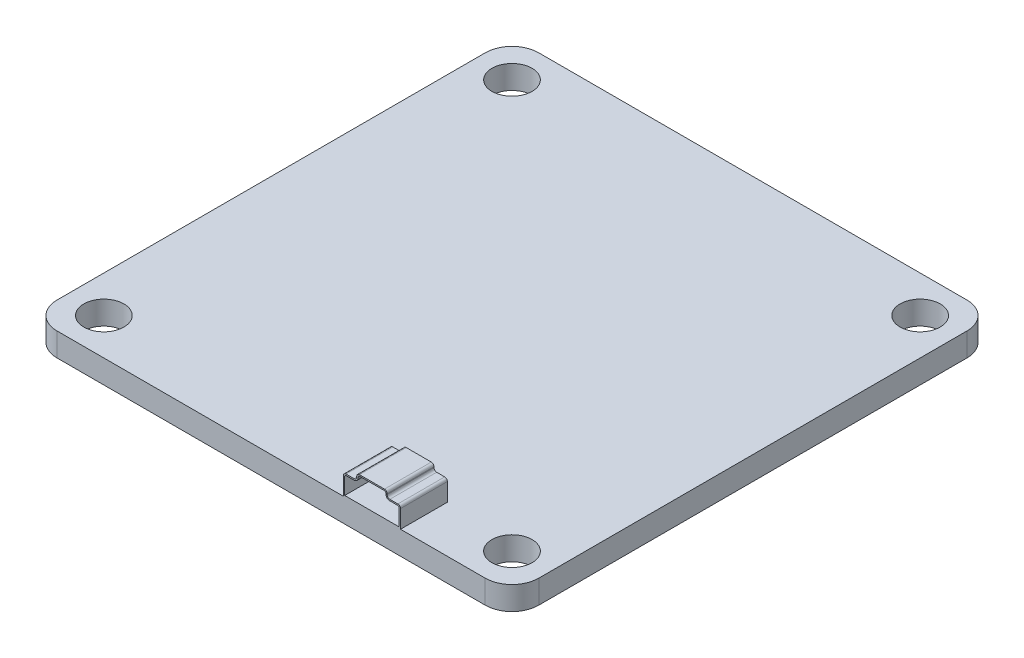
from build123d import *

# Parameters (mm, degrees)
SKETCH1_R           = 1.5
BOSS_EXTRUDE1_DEPTH = 1.75
BOSS_EXTRUDE2_DEPTH = 3
BOSS_EXTRUDE3_DEPTH = 0.5
CUT_EXTRUDE1_REACH  = 39.34
SKETCH6_R           = 0.257889393


with BuildPart() as part:
    # Sketch1 → Boss-Extrude1 (new body)
    with BuildSketch(Plane(origin=(0, 0, 0), x_dir=(1, 0, 0), z_dir=(0, 1, 0))):
        with BuildLine():
            Line((-16, 18), (16, 18))
            ThreePointArc((16, 18), (17.414213562, 17.414213562), (18, 16))
            Line((18, 16), (18, -16))
            ThreePointArc((18, -16), (17.414213562, -17.414213562), (16, -18))
            Line((16, -18), (-16, -18))
            ThreePointArc((-16, -18), (-17.414213562, -17.414213562), (-18, -16))
            Line((-18, -16), (-18, 16))
            ThreePointArc((-18, 16), (-17.414213562, 17.414213562), (-16, 18))
        make_face()
        with Locations(Location((-15.25, 15.25, 0), (0, 0, 270))):
            Circle(SKETCH1_R, mode=Mode.SUBTRACT)
        with Locations(Location((15.25, 15.25, 0), (0, 0, 270))):
            Circle(SKETCH1_R, mode=Mode.SUBTRACT)
        with Locations(Location((15.25, -15.25, 0), (0, 0, 270))):
            Circle(SKETCH1_R, mode=Mode.SUBTRACT)
        with Locations(Location((-15.25, -15.25, 0), (0, 0, 270))):
            Circle(SKETCH1_R, mode=Mode.SUBTRACT)
    extrude(amount=BOSS_EXTRUDE1_DEPTH)

    # Sketch2 → Boss-Extrude2 (add)
    with BuildSketch(Plane.XY.offset(18)):
        with BuildLine():
            Line((5.398268184, 1.75), (9.670358353, 1.75))
            Line((9.670358353, 1.75), (9.670358353, 3.08952509))
            ThreePointArc((9.670358353, 3.08952509), (9.61177971, 3.230946447), (9.470358353, 3.28952509))
            Line((9.470358353, 3.28952509), (8.870358353, 3.28952509))
            ThreePointArc((8.870358353, 3.28952509), (8.728936997, 3.348103734), (8.670358353, 3.48952509))
            Line((8.670358353, 3.48952509), (8.670358353, 3.55))
            ThreePointArc((8.670358353, 3.55), (8.61177971, 3.691421356), (8.470358353, 3.75))
            Line((8.470358353, 3.75), (6.598268184, 3.75))
            ThreePointArc((6.598268184, 3.75), (6.456846827, 3.691421356), (6.398268184, 3.55))
            Line((6.398268184, 3.55), (6.398268184, 3.48952509))
            ThreePointArc((6.398268184, 3.48952509), (6.33968954, 3.348103734), (6.198268184, 3.28952509))
            Line((6.198268184, 3.28952509), (5.598268184, 3.28952509))
            ThreePointArc((5.598268184, 3.28952509), (5.456846827, 3.230946447), (5.398268184, 3.08952509))
            Line((5.398268184, 3.08952509), (5.398268184, 1.75))
        make_face()
        with BuildLine():
            Line((6.598268184, 3.65), (8.470358353, 3.65))
            ThreePointArc((8.470358353, 3.65), (8.541069032, 3.620710678), (8.570358353, 3.55))
            Line((8.570358353, 3.55), (8.570358353, 3.48952509))
            ThreePointArc((8.570358353, 3.48952509), (8.658226319, 3.277393056), (8.870358353, 3.18952509))
            Line((8.870358353, 3.18952509), (9.470358353, 3.18952509))
            ThreePointArc((9.470358353, 3.18952509), (9.541069032, 3.160235768), (9.570358353, 3.08952509))
            Line((9.570358353, 3.08952509), (9.570358353, 1.85))
            Line((9.570358353, 1.85), (5.498268184, 1.85))
            Line((5.498268184, 1.85), (5.498268184, 3.08952509))
            ThreePointArc((5.498268184, 3.08952509), (5.527557505, 3.160235768), (5.598268184, 3.18952509))
            Line((5.598268184, 3.18952509), (6.198268184, 3.18952509))
            ThreePointArc((6.198268184, 3.18952509), (6.410400218, 3.277393056), (6.498268184, 3.48952509))
            Line((6.498268184, 3.48952509), (6.498268184, 3.55))
            ThreePointArc((6.498268184, 3.55), (6.527557505, 3.620710678), (6.598268184, 3.65))
        make_face(mode=Mode.SUBTRACT)
    extrude(amount=-BOSS_EXTRUDE2_DEPTH)

    # Sketch4 → Boss-Extrude3 (add)
    with BuildSketch(Plane(origin=(0, 0, 15), x_dir=(-1, 0, 0), z_dir=(0, 0, -1))):
        with BuildLine():
            Line((-5.398268184, 1.75), (-5.398268184, 3.08952509))
            ThreePointArc((-5.398268184, 3.08952509), (-5.456846827, 3.230946447), (-5.598268184, 3.28952509))
            Line((-5.598268184, 3.28952509), (-6.198268184, 3.28952509))
            ThreePointArc((-6.198268184, 3.28952509), (-6.33968954, 3.348103734), (-6.398268184, 3.48952509))
            Line((-6.398268184, 3.48952509), (-6.398268184, 3.55))
            ThreePointArc((-6.398268184, 3.55), (-6.456846827, 3.691421356), (-6.598268184, 3.75))
            Line((-6.598268184, 3.75), (-8.470358353, 3.75))
            ThreePointArc((-8.470358353, 3.75), (-8.61177971, 3.691421356), (-8.670358353, 3.55))
            Line((-8.670358353, 3.55), (-8.670358353, 3.48952509))
            ThreePointArc((-8.670358353, 3.48952509), (-8.728936997, 3.348103734), (-8.870358353, 3.28952509))
            Line((-8.870358353, 3.28952509), (-9.470358353, 3.28952509))
            ThreePointArc((-9.470358353, 3.28952509), (-9.61177971, 3.230946447), (-9.670358353, 3.08952509))
            Line((-9.670358353, 3.08952509), (-9.670358353, 1.75))
            Line((-9.670358353, 1.75), (-5.398268184, 1.75))
        make_face()
    extrude(amount=BOSS_EXTRUDE3_DEPTH)

    # Sketch6 → Cut-Extrude1 (cut, up to next)
    with BuildSketch(Plane(origin=(0, 0, 14.5), x_dir=(-1, 0, 0), z_dir=(0, 0, -1)), mode=Mode.PRIVATE) as cut_extrude1_sk1:
        with Locations((-7.588156424, 2.845218845)):
            Circle(SKETCH6_R)
    cut_extrude1_tool1 = extrude(cut_extrude1_sk1.sketch, amount=-CUT_EXTRUDE1_REACH, mode=Mode.PRIVATE) & part.part
    # Sketch6 → Cut-Extrude1 (cut, up to next)
    with BuildSketch(Plane(origin=(0, 0, 14.5), x_dir=(-1, 0, 0), z_dir=(0, 0, -1)), mode=Mode.PRIVATE) as cut_extrude1_sk2:
        with Locations((-8.258693336, 2.845218845)):
            Circle(SKETCH6_R)
    cut_extrude1_tool2 = extrude(cut_extrude1_sk2.sketch, amount=-CUT_EXTRUDE1_REACH, mode=Mode.PRIVATE) & part.part
    # Sketch6 → Cut-Extrude1 (cut, up to next)
    with BuildSketch(Plane(origin=(0, 0, 14.5), x_dir=(-1, 0, 0), z_dir=(0, 0, -1)), mode=Mode.PRIVATE) as cut_extrude1_sk3:
        with Locations((-6.953864749, 2.845218845)):
            Circle(SKETCH6_R)
    cut_extrude1_tool3 = extrude(cut_extrude1_sk3.sketch, amount=-CUT_EXTRUDE1_REACH, mode=Mode.PRIVATE) & part.part
    add(cut_extrude1_tool1.solids().sort_by_distance((7.588156, 2.845219, 14.5))[0], mode=Mode.SUBTRACT)
    add(cut_extrude1_tool2.solids().sort_by_distance((8.258693, 2.845219, 14.5))[0], mode=Mode.SUBTRACT)
    add(cut_extrude1_tool3.solids().sort_by_distance((6.953865, 2.845219, 14.5))[0], mode=Mode.SUBTRACT)


solid = part.part
